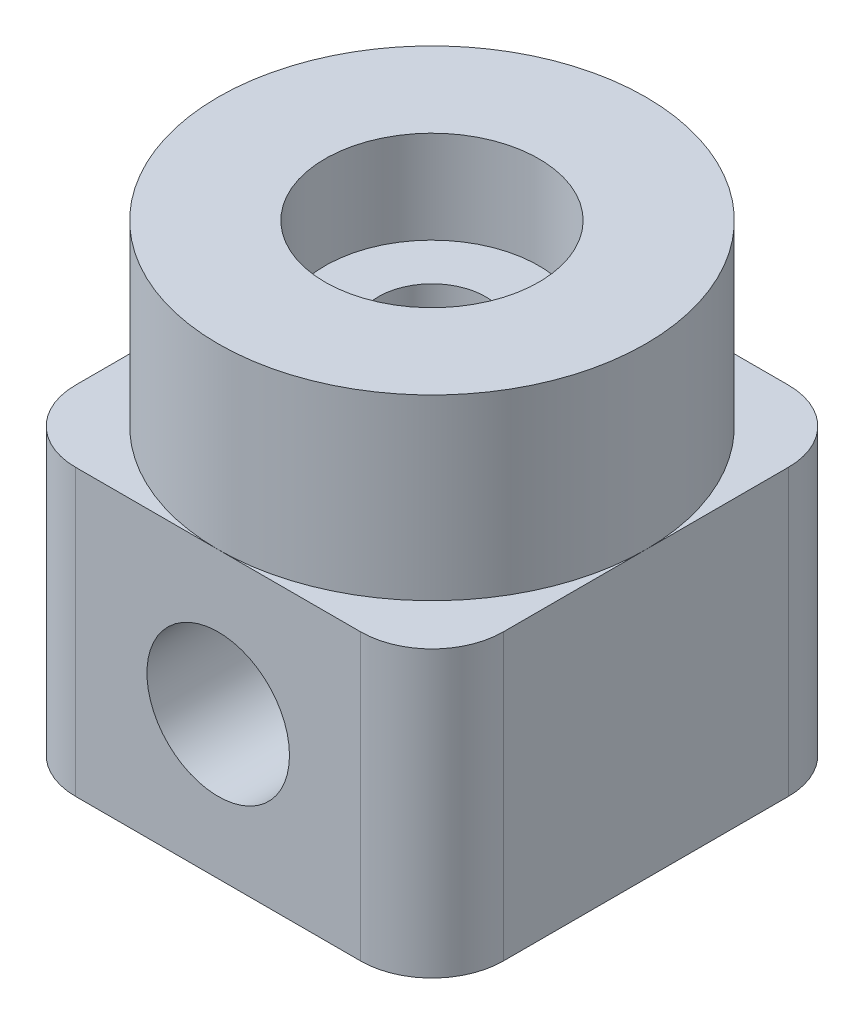
from build123d import *

# Parameters (mm, degrees)
SKETCH_1_R          = 6
EXTRUDE_1_DEPTH     = 5
SKETCH_2_W          = 12
SKETCH_2_H          = 8
EXTRUDE_2_DEPTH     = 6
SKETCH_2_2_W        = 12
SKETCH_2_2_H        = 8
EXTRUDE_3_DEPTH     = 6
SKETCH_3_R          = 2
CUT_EXTRUDE_1_DEPTH = 16.620499352
SKETCH_4_R          = 1.5
CUT_EXTRUDE_2_DEPTH = 5
FILLET_1_R          = 2
SKETCH_5_R          = 3
CUT_EXTRUDE_4_DEPTH = 2.6


with BuildPart() as part:
    # 草图1 → 凸台-拉伸1 (new body)
    with BuildSketch(Plane(origin=(0, 0, 0), x_dir=(1, 0, 0), z_dir=(0, 1, 0))):
        Circle(SKETCH_1_R)
    extrude(amount=EXTRUDE_1_DEPTH)

    # 草图2 → 凸台-拉伸2 (add)
    with BuildSketch(Plane.XY):
        with Locations((0, -4)):
            Rectangle(SKETCH_2_W, SKETCH_2_H)
    extrude(amount=-EXTRUDE_2_DEPTH)

    # 草图2<2> → 凸台-拉伸3 (add)
    with BuildSketch(Plane.XY):
        with Locations((0, -4)):
            Rectangle(SKETCH_2_2_W, SKETCH_2_2_H)
    extrude(amount=EXTRUDE_3_DEPTH)

    # 草图3 → 切除-拉伸1 (cut, through all)
    with BuildSketch(Plane.XY.offset(6)):
        with Locations((0, -4)):
            Circle(SKETCH_3_R)
    extrude(amount=-CUT_EXTRUDE_1_DEPTH, mode=Mode.SUBTRACT)

    # 草图4 → 切除-拉伸2 (cut)
    with BuildSketch(Plane(origin=(0, 5, 0), x_dir=(1, 0, 0), z_dir=(0, 1, 0))):
        Circle(SKETCH_4_R)
    extrude(amount=-CUT_EXTRUDE_2_DEPTH, mode=Mode.SUBTRACT)

    # 圆角1
    fillet_1_edges = [part.edges().sort_by_distance(p)[0] for p in [
        (-6, -4, -6),
        (6, -4, -6),
        (6, -4, 6),
        (-6, -4, 6),
    ]]
    fillet(fillet_1_edges, radius=FILLET_1_R)

    # 草图5 → 切除-拉伸4 (cut)
    with BuildSketch(Plane(origin=(0, 5, 0), x_dir=(1, 0, 0), z_dir=(0, 1, 0))):
        Circle(SKETCH_5_R)
    extrude(amount=-CUT_EXTRUDE_4_DEPTH, mode=Mode.SUBTRACT)


solid = part.part
